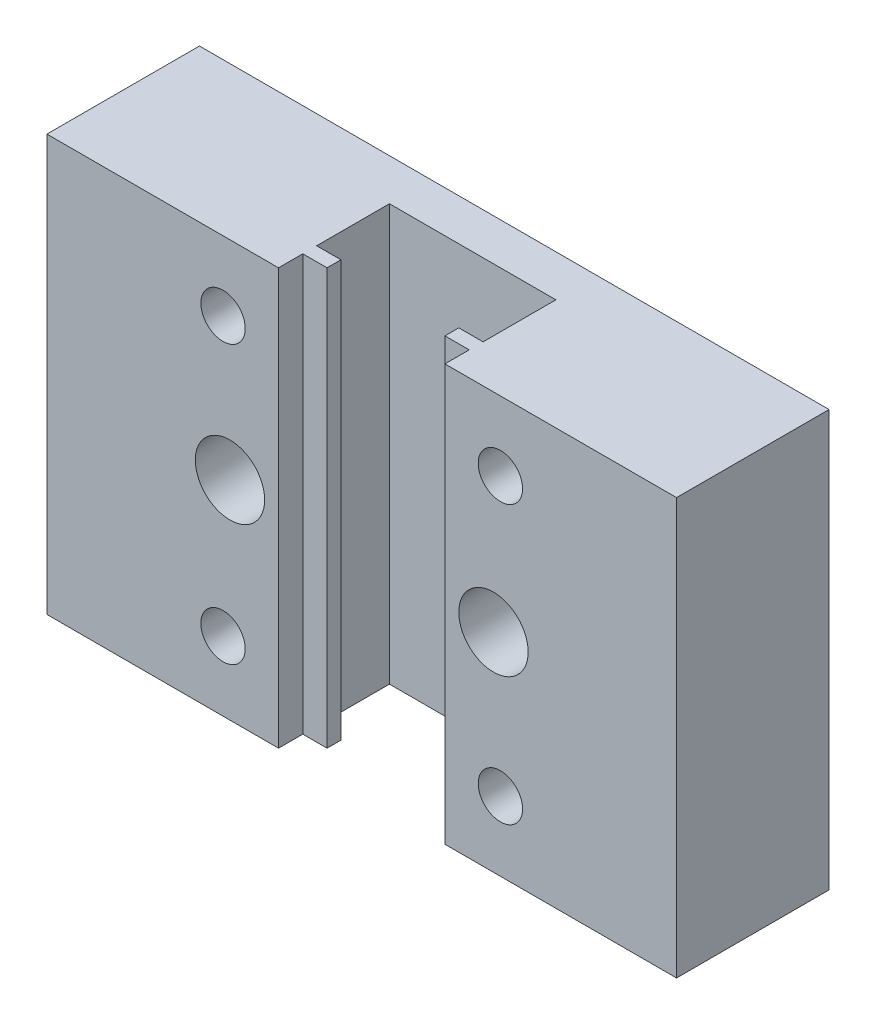
from build123d import *

# Parameters (mm, degrees)
BOSS_EXTRUDE1_DEPTH   = 30
F_3_0MM_DOWEL_HOLE1_D = 3.2
SKETCH6_R             = 2.5
CUT_EXTRUDE1_DEPTH    = 8


with BuildPart() as part:
    # Sketch1 → Boss-Extrude1 (new body)
    with BuildSketch(Plane(origin=(0, 0, 0), x_dir=(1, 0, 0), z_dir=(0, 1, 0))):
        Polygon((-6, -1.25), (-4.25, -1.25), (-4.25, -2.25), (-6, -2.25), (-6, -4), (-22.7, -4), (-22.7, 7), (22.7, 7), (22.7, -4), (6, -4), (6, -2.25), (4.25, -2.25), (4.25, -1.25), (6, -1.25), (6, 4), (-6, 4), align=None)
    extrude(amount=BOSS_EXTRUDE1_DEPTH)

    # Ø3.0mm Dowel Hole1 (through all)
    with Locations(Plane.XY.offset(4)):
        with Locations((-10, 25), (10, 25), (10, 5), (-10, 5)):
            Hole(F_3_0MM_DOWEL_HOLE1_D / 2)

    # Sketch6 → Cut-Extrude1 (cut)
    with BuildSketch(Plane.XY.offset(4)):
        with Locations((9.5, 15)):
            Circle(SKETCH6_R)
        with Locations((-9.5, 15)):
            Circle(SKETCH6_R)
    extrude(amount=-CUT_EXTRUDE1_DEPTH, mode=Mode.SUBTRACT)


solid = part.part
